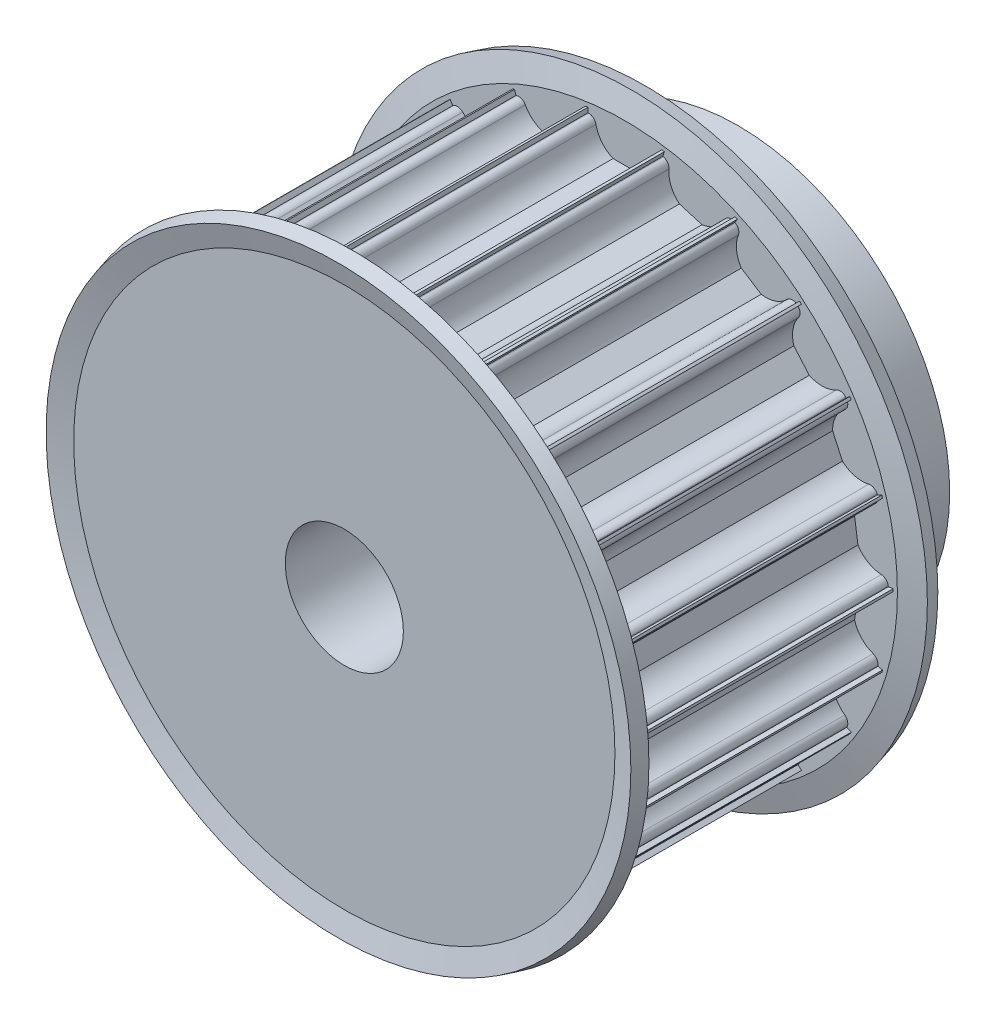
from build123d import *

# Parameters (mm, degrees)
CUT_EXTRUDE1_REACH = 57.544
CIRPATTERN1_COUNT  = 22


with BuildPart() as part:
    # Sketch1 → Revolve1 (revolve)
    with BuildSketch(Plane(origin=(0, 0, 0), x_dir=(0, 0, -1), z_dir=(1, 0, 0)), mode=Mode.PRIVATE) as revolve1_sk:
        Polygon((0, 6), (40, 6), (40, 21.5), (30, 21.5), (30, 27.25), (0, 27.25), align=None)
    revolve(revolve1_sk.sketch.rotate(Axis((0, 0, 0), (0, 0, -1)), 90), axis=Axis((0, 0, 0), (0, 0, -1)))

    # Sketch2 → Cut-Extrude1 (cut, up to next)
    with BuildSketch(Plane.XY, mode=Mode.PRIVATE) as cut_extrude1_sk1:
        with BuildLine():
            Line((-3.674234614, 26.5), (-3.75, 26.5))
            Line((-3.75, 26.5), (-3.75, 28.5))
            Line((-3.75, 28.5), (3.75, 28.5))
            Line((3.75, 28.5), (3.75, 26.5))
            Line((3.75, 26.5), (3.674234614, 26.5))
            ThreePointArc((3.674234614, 26.5), (3.199892965, 26.330947502), (2.939387691, 25.9))
            ThreePointArc((2.939387691, 25.9), (2.331759211, 24.612435701), (1.198957881, 23.75))
            Line((1.198957881, 23.75), (-1.198957881, 23.75))
            ThreePointArc((-1.198957881, 23.75), (-2.331759211, 24.612435701), (-2.939387691, 25.9))
            ThreePointArc((-2.939387691, 25.9), (-3.199892965, 26.330947502), (-3.674234614, 26.5))
        make_face()
    cut_extrude1_tool1 = extrude(cut_extrude1_sk1.sketch, amount=-CUT_EXTRUDE1_REACH, mode=Mode.PRIVATE) & part.part
    cut_extrude1 = cut_extrude1_tool1.solids().sort_by_distance((0, 26.435169, 0))[0]
    add(cut_extrude1, mode=Mode.SUBTRACT)

    # CirPattern1: Cut-Extrude1 ×22 about axis
    cirpattern1_axis = Axis((0, 0, 0), (0, 0, 1))
    for i in range(1, CIRPATTERN1_COUNT):
        add(cut_extrude1.rotate(cirpattern1_axis, i * 360 / CIRPATTERN1_COUNT), mode=Mode.SUBTRACT)

    # Sketch3 → Revolve2 (revolve)
    with BuildSketch(Plane(origin=(0, 0, 0), x_dir=(0, 0, -1), z_dir=(1, 0, 0)), mode=Mode.PRIVATE) as revolve2_sk:
        Polygon((30, 21.5), (30, 27.492521254), (30.591966801, 29.701771432), (29.143078062, 30.09), (28.5, 27.69), (28.5, 21.5), align=None)
        Polygon((1.5, 27.69), (1.5, 21.5), (0, 21.5), (0, 27.492521254), (-0.591966801, 29.701771432), (0.856921938, 30.09), align=None)
    revolve(revolve2_sk.sketch.rotate(Axis((0, 0, 85.541686688), (0, 0, -1)), 90), axis=Axis((0, 0, 85.541686688), (0, 0, -1)))


solid = part.part
